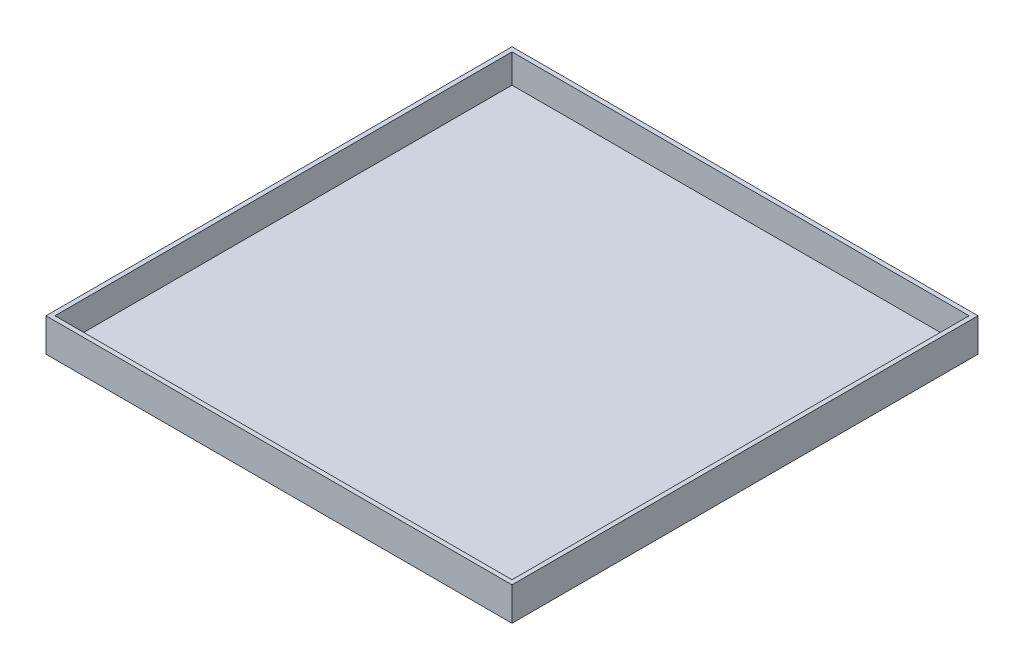
from build123d import *

# Parameters (mm, degrees)
SKETCH_1_W      = 210
SKETCH_1_H      = 210
EXTRUDE_1_DEPTH = 15
SHELL_1_T       = -2


with BuildPart() as part:
    # 草图1 → 凸台-拉伸1 (new body)
    with BuildSketch(Plane(origin=(0, 0, 0), x_dir=(1, 0, 0), z_dir=(0, 1, 0))):
        with Locations((105, 105)):
            Rectangle(SKETCH_1_W, SKETCH_1_H)
    extrude(amount=EXTRUDE_1_DEPTH)

    # 抽壳1
    shell_1_openings = [part.faces().sort_by_distance(p)[0] for p in [
        (105, 15, -105),
    ]]
    offset(amount=SHELL_1_T, openings=shell_1_openings, kind=Kind.INTERSECTION)


solid = part.part
